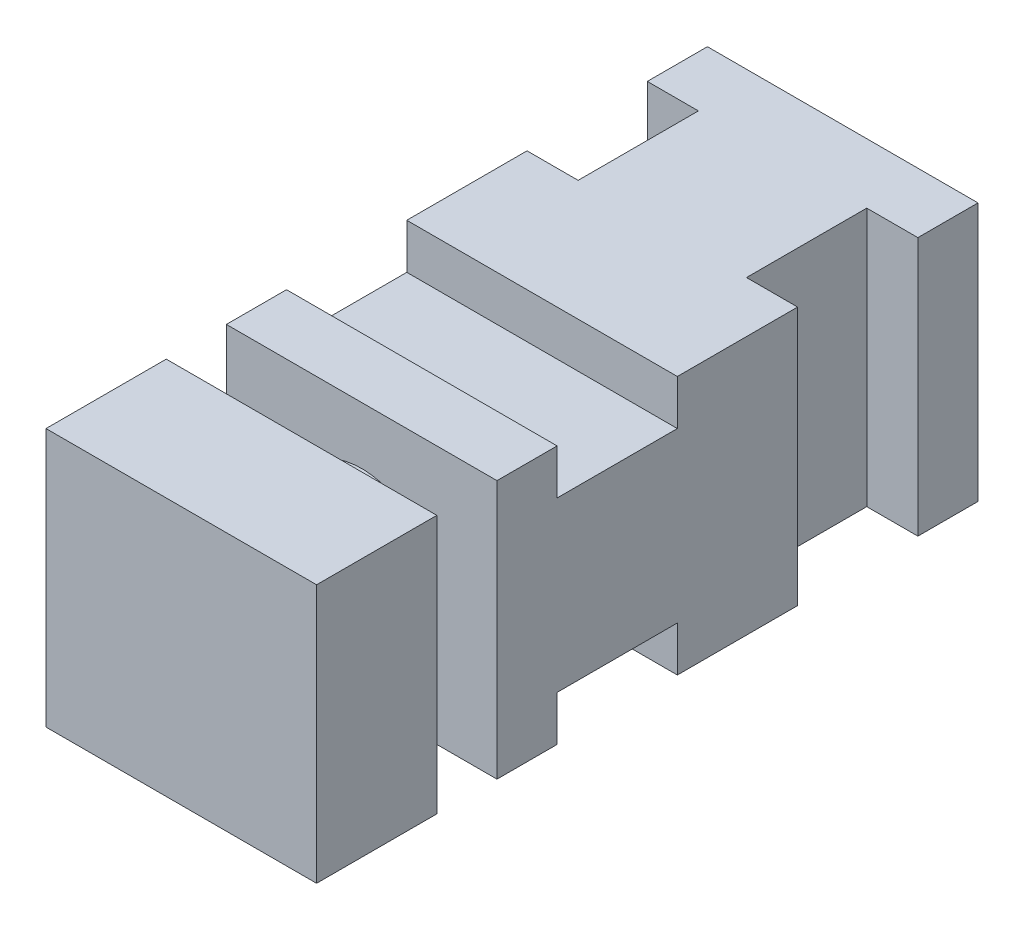
from build123d import *

# Parameters (mm, degrees)
SKETCH_2_W               = 2.25
SKETCH_2_H               = 2.15
EXTRUDE_4_DEPTH          = 1
SKETCH_4_R               = 0.6
EXTRUDE_5_DEPTH          = 0.5
SKETCH_5_W               = 2.25
SKETCH_5_H               = 2.15
EXTRUDE_6_DEPTH          = 2
CUT_EXTRUDE_1_DEPTH      = 4.531023223
CUT_EXTRUDE_1_DEPTH_BACK = 4.531023223
SKETCH_6_W               = 0.5
SKETCH_6_H               = 0.375
SKETCH_7_W               = 2.25
SKETCH_7_H               = 2.15
EXTRUDE_7_DEPTH          = 2
CUT_EXTRUDE_2_DEPTH      = 6.112545843
CUT_EXTRUDE_2_DEPTH_BACK = 6.112545843
SKETCH_9_W               = 0.425
SKETCH_9_H               = 1


with BuildPart() as part:
    # 草图2 → 凸台-拉伸4 (new body)
    with BuildSketch(Plane.XY):
        Rectangle(SKETCH_2_W, SKETCH_2_H)
    extrude(amount=EXTRUDE_4_DEPTH)

    # 草图4 → 凸台-拉伸5 (add)
    with BuildSketch(Plane(origin=(0, 0, 0), x_dir=(-1, 0, 0), z_dir=(0, 0, -1))):
        Circle(SKETCH_4_R)
    extrude(amount=EXTRUDE_5_DEPTH)

    # 草图5 → 凸台-拉伸6 (add)
    with BuildSketch(Plane(origin=(0, 0, -0.5), x_dir=(-1, 0, 0), z_dir=(0, 0, -1))):
        Rectangle(SKETCH_5_W, SKETCH_5_H)
    extrude(amount=EXTRUDE_6_DEPTH)

    # 草图6 → 切除-拉伸1 (cut, two sides: drawn at the far end of the back side and taken through both)
    with BuildSketch(Plane.ZY.offset(1.125).offset(-CUT_EXTRUDE_1_DEPTH_BACK)):
        with Locations((-1.75, -0.8875)):
            Rectangle(SKETCH_6_W, SKETCH_6_H)
        with Locations((-1.25, -0.8875)):
            Rectangle(SKETCH_6_W, SKETCH_6_H)
        with Locations((-1.75, 0.8875)):
            Rectangle(SKETCH_6_W, SKETCH_6_H)
        with Locations((-1.25, 0.8875)):
            Rectangle(SKETCH_6_W, SKETCH_6_H)
    extrude(amount=CUT_EXTRUDE_1_DEPTH + CUT_EXTRUDE_1_DEPTH_BACK, mode=Mode.SUBTRACT)

    # 草图7 → 凸台-拉伸7 (add)
    with BuildSketch(Plane(origin=(0, 0, -2.5), x_dir=(-1, 0, 0), z_dir=(0, 0, -1))):
        Rectangle(SKETCH_7_W, SKETCH_7_H)
    extrude(amount=EXTRUDE_7_DEPTH)

    # 草图9 → 切除-拉伸2 (cut, two sides: drawn at the far end of the back side and taken through both)
    with BuildSketch(Plane.XZ.offset(1.075).offset(-CUT_EXTRUDE_2_DEPTH_BACK)):
        with Locations((-0.9125, -3.5)):
            Rectangle(SKETCH_9_W, SKETCH_9_H)
        with Locations((0.9125, -3.5)):
            Rectangle(SKETCH_9_W, SKETCH_9_H)
    extrude(amount=CUT_EXTRUDE_2_DEPTH + CUT_EXTRUDE_2_DEPTH_BACK, mode=Mode.SUBTRACT)


solid = part.part
